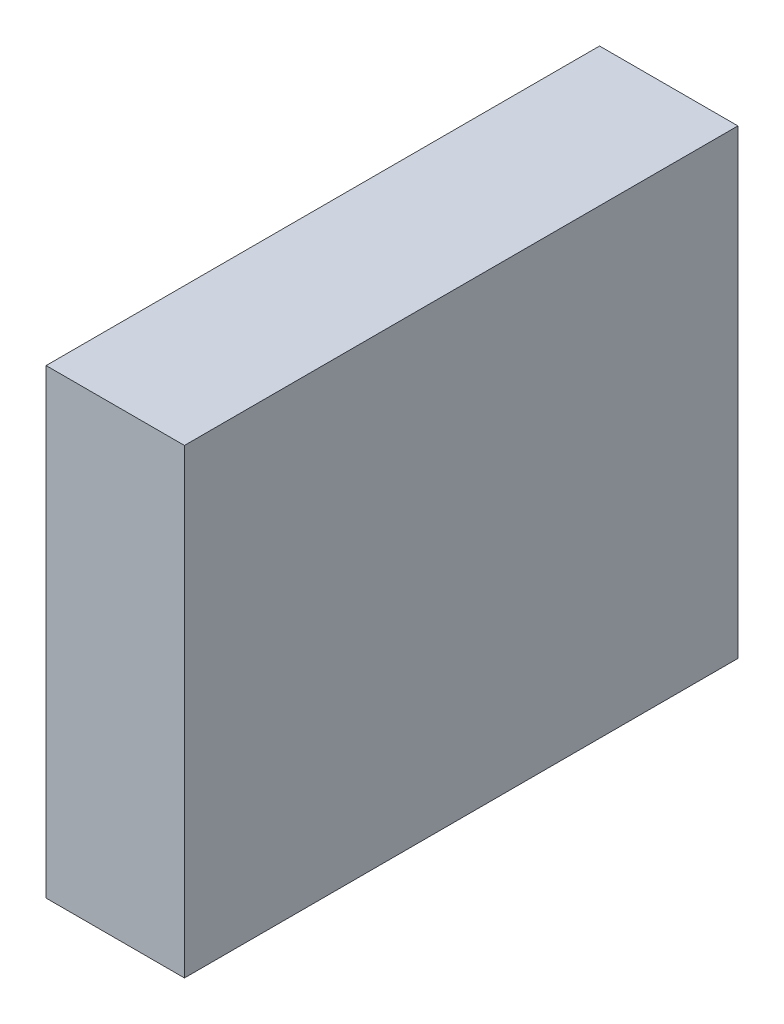
from build123d import *

# Parameters (mm, degrees)
SKETCH1_W           = 152.4
SKETCH1_H           = 508
BOSS_EXTRUDE1_DEPTH = 609.6


with BuildPart() as part:
    # Sketch1 → Boss-Extrude1 (new body)
    with BuildSketch(Plane.XY):
        Rectangle(SKETCH1_W, SKETCH1_H)
    extrude(amount=BOSS_EXTRUDE1_DEPTH)


solid = part.part
